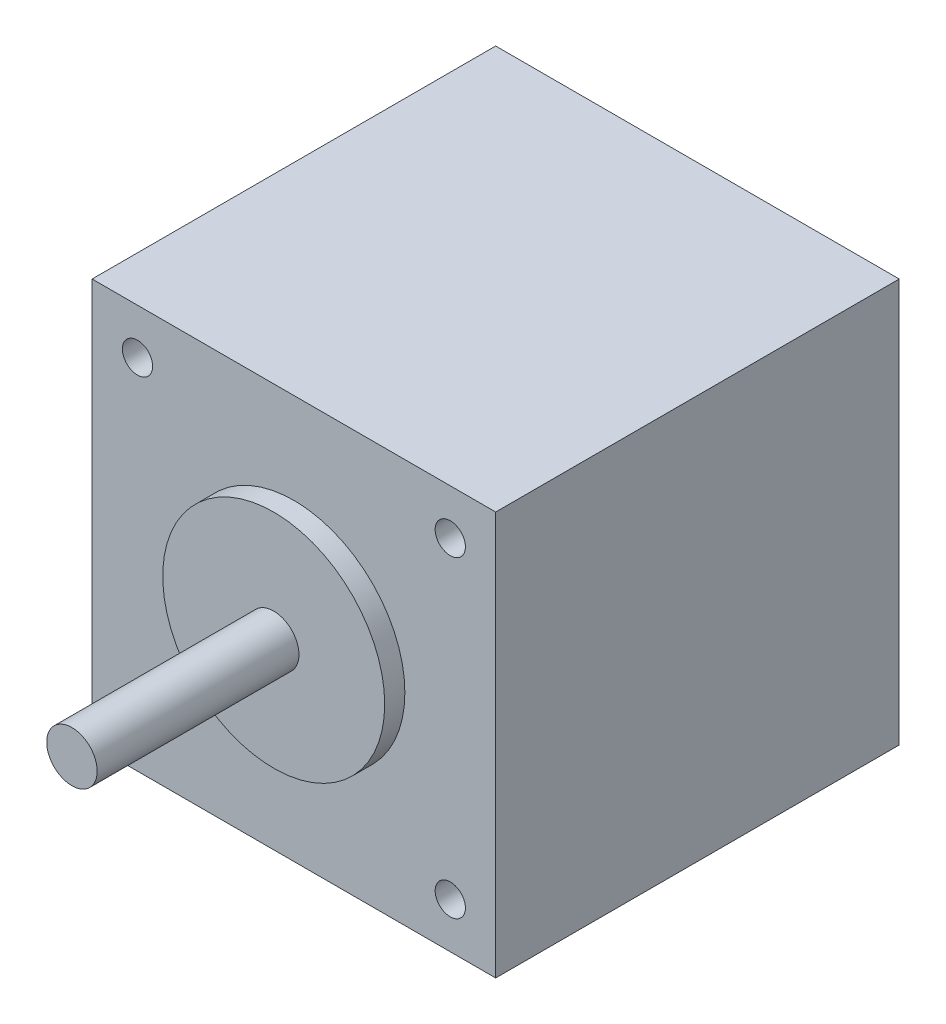
from build123d import *

# Parameters (mm, degrees)
SKETCH1_W           = 40
SKETCH1_H           = 40
BOSS_EXTRUDE1_DEPTH = 40
SKETCH2_R           = 11
BOSS_EXTRUDE2_DEPTH = 2
SKETCH3_R           = 2.5
BOSS_EXTRUDE3_DEPTH = 20
SKETCH4_R           = 1.5
CUT_EXTRUDE1_DEPTH  = 49.989794856
SKETCH4_3_R         = 1.5
CUT_EXTRUDE2_DEPTH  = 49.989794856


with BuildPart() as part:
    # Sketch1 → Boss-Extrude1 (new body)
    with BuildSketch(Plane.XY):
        Rectangle(SKETCH1_W, SKETCH1_H)
    extrude(amount=BOSS_EXTRUDE1_DEPTH)

    # Sketch2 → Boss-Extrude2 (add)
    with BuildSketch(Plane.XY.offset(40)):
        Circle(SKETCH2_R)
    extrude(amount=BOSS_EXTRUDE2_DEPTH)

    # Sketch3 → Boss-Extrude3 (add)
    with BuildSketch(Plane.XY.offset(42)):
        Circle(SKETCH3_R)
    extrude(amount=BOSS_EXTRUDE3_DEPTH)

    # Sketch4 → Cut-Extrude1 (cut, through all)
    with BuildSketch(Plane.XY.offset(40)):
        with Locations((-15.5, 15.5)):
            Circle(SKETCH4_R)
        with Locations((-15.5, -15.5)):
            Circle(SKETCH4_R)
        with Locations((15.5, 15.5)):
            Circle(SKETCH4_R)
    extrude(amount=-CUT_EXTRUDE1_DEPTH, mode=Mode.SUBTRACT)

    # Sketch4<3> → Cut-Extrude2 (cut, through all)
    with BuildSketch(Plane.XY.offset(40)):
        with Locations((-15.5, 15.5)):
            Circle(SKETCH4_3_R)
        with Locations((-15.5, -15.5)):
            Circle(SKETCH4_3_R)
        with Locations((15.5, -15.5)):
            Circle(SKETCH4_3_R)
        with Locations((15.5, 15.5)):
            Circle(SKETCH4_3_R)
    extrude(amount=-CUT_EXTRUDE2_DEPTH, mode=Mode.SUBTRACT)


solid = part.part
